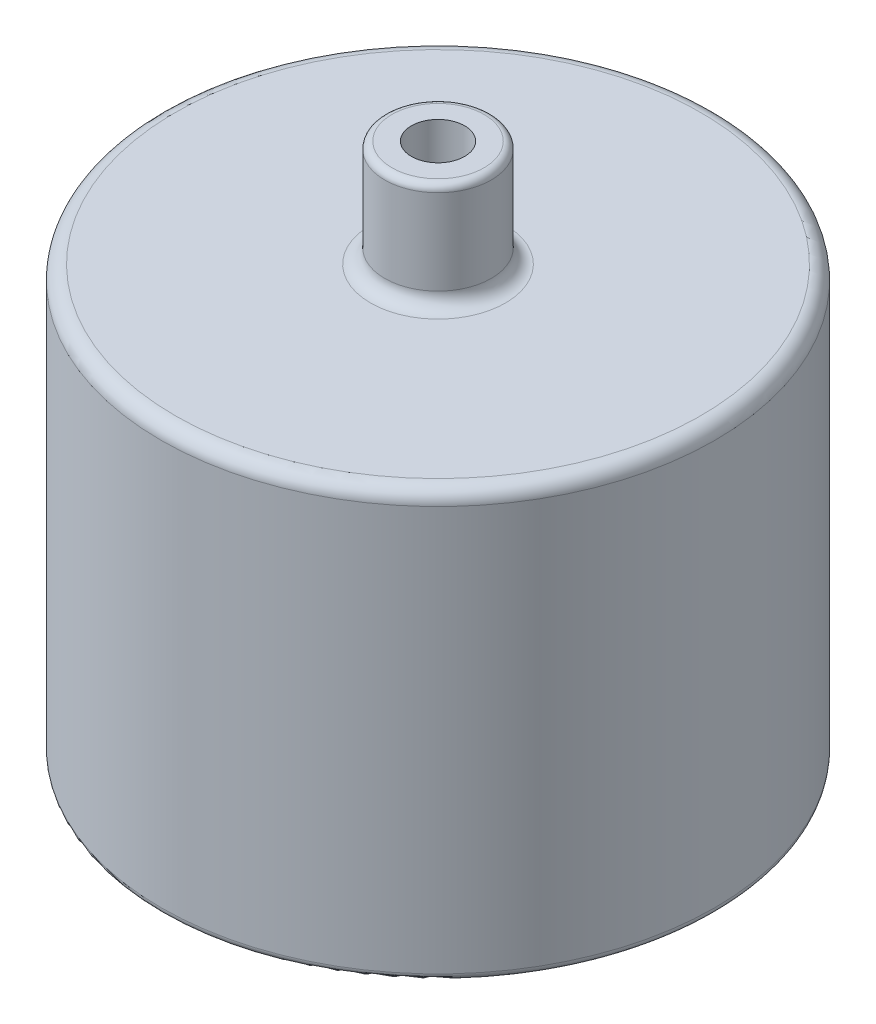
from build123d import *

# Parameters (mm, degrees)
SKETCH1_R           = 49.53
BOSS_EXTRUDE1_DEPTH = 76.2
SKETCH2_R           = 46.355
CUT_EXTRUDE1_DEPTH  = 69.85
SKETCH4_R           = 9.525
BOSS_EXTRUDE2_DEPTH = 19.05
CUT_EXTRUDE2_REACH  = 120.233
SKETCH5_R           = 4.7625
FILLET1_R           = 2.54
FILLET2_R           = 1.27
FILLET3_R           = 1.27


with BuildPart() as part:
    # Sketch1 → Boss-Extrude1 (new body)
    with BuildSketch(Plane(origin=(0, 0, 0), x_dir=(1, 0, 0), z_dir=(0, 1, 0))):
        with Locations(Location((0, 0, 0), (0, 0, 90))):
            Circle(SKETCH1_R)
    extrude(amount=BOSS_EXTRUDE1_DEPTH)

    # Sketch2 → Cut-Extrude1 (cut)
    with BuildSketch(Plane.XZ):
        with Locations(Location((0, 0, 0), (0, 0, 270))):
            Circle(SKETCH2_R)
    extrude(amount=-CUT_EXTRUDE1_DEPTH, mode=Mode.SUBTRACT)

    # Sketch4 → Boss-Extrude2 (add)
    with BuildSketch(Plane(origin=(0, 76.2, 0), x_dir=(1, 0, 0), z_dir=(0, 1, 0))):
        with Locations(Location((0, 0, 0), (0, 0, 90))):
            Circle(SKETCH4_R)
    extrude(amount=BOSS_EXTRUDE2_DEPTH)

    # Sketch5 → Cut-Extrude2 (cut, up to next)
    with BuildSketch(Plane(origin=(0, 95.25, 0), x_dir=(1, 0, 0), z_dir=(0, 1, 0)), mode=Mode.PRIVATE) as cut_extrude2_sk1:
        with Locations(Location((0, 0, 0), (0, 0, 270))):
            Circle(SKETCH5_R)
    cut_extrude2_tool1 = extrude(cut_extrude2_sk1.sketch, amount=-CUT_EXTRUDE2_REACH, mode=Mode.PRIVATE) & part.part
    add(cut_extrude2_tool1.solids().sort_by_distance((0, 95.25, 0))[0], mode=Mode.SUBTRACT)

    # Fillet1
    fillet1_edges = [part.edges().sort_by_distance(p)[0] for p in [
        (0, 76.2, 9.525),
        (0, 76.2, 49.53),
    ]]
    fillet(fillet1_edges, radius=FILLET1_R)

    # Fillet2
    fillet2_edges = [part.edges().sort_by_distance(p)[0] for p in [
        (0, 95.25, 9.525),
        (0, 0, 49.53),
    ]]
    fillet(fillet2_edges, radius=FILLET2_R)

    # Fillet3
    fillet3_edges = [part.edges().sort_by_distance(p)[0] for p in [
        (0, 69.85, -4.7625),
        (0, 69.85, 46.355),
    ]]
    fillet(fillet3_edges, radius=FILLET3_R)


solid = part.part
